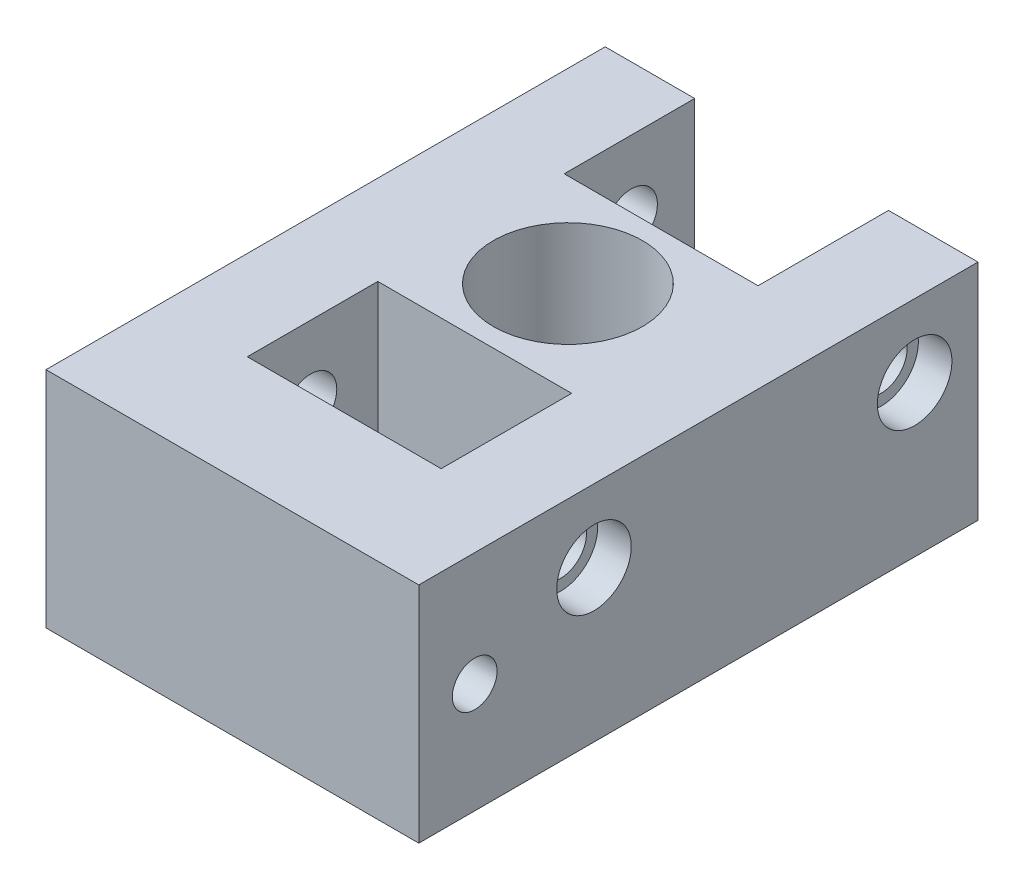
from build123d import *

# Parameters (mm, degrees)
SKETCH_1_W          = 10
SKETCH_1_H          = 12
EXTRUDE_1_DEPTH     = 6
SKETCH_2_R          = 1
CUT_EXTRUDE_1_DEPTH = 17.733200531
SKETCH_2_3_R        = 2
CUT_EXTRUDE_2_DEPTH = 4
SKETCH_3_R          = 2
CUT_EXTRUDE_3_DEPTH = 17.733200531
SKETCH_4_W          = 5.2
SKETCH_4_H          = 3.5
CUT_EXTRUDE_4_DEPTH = 4
SKETCH_6_R          = 0.7
CUT_EXTRUDE_5_DEPTH = 17.733200531
SKETCH_6_3_R        = 1
CUT_EXTRUDE_6_DEPTH = 0.9
CUT_EXTRUDE_START   = -9.1
SKETCH_6_4_R        = 1
CUT_EXTRUDE_7_DEPTH = 0.9
SKETCH_7_W          = 10
SKETCH_7_H          = 6
EXTRUDE_3_DEPTH     = 3
SKETCH_8_R          = 0.6
CUT_EXTRUDE_8_DEPTH = 20


with BuildPart() as part:
    # 草图1 → 凸台-拉伸1 (new body)
    with BuildSketch(Plane(origin=(0, 0, 0), x_dir=(1, 0, 0), z_dir=(0, 1, 0))):
        with Locations((5, -6)):
            Rectangle(SKETCH_1_W, SKETCH_1_H)
    extrude(amount=EXTRUDE_1_DEPTH)

    # 草图2 → 切除-拉伸1 (cut, through all)
    with BuildSketch(Plane(origin=(0, 6, 0), x_dir=(1, 0, 0), z_dir=(0, 1, 0))):
        with Locations(Location((5, -1.5, 0), (0, 0, 270))):
            Circle(SKETCH_2_R)
        with Locations(Location((5, -10.5, 0), (0, 0, 270))):
            Circle(SKETCH_2_R)
    extrude(amount=-CUT_EXTRUDE_1_DEPTH, mode=Mode.SUBTRACT)

    # 草图2<3> → 切除-拉伸2 (cut)
    with BuildSketch(Plane(origin=(0, 6, 0), x_dir=(1, 0, 0), z_dir=(0, 1, 0))):
        with Locations((5, -1.5)):
            Circle(SKETCH_2_3_R)
        with Locations((5, -10.5)):
            Circle(SKETCH_2_3_R)
    extrude(amount=-CUT_EXTRUDE_2_DEPTH, mode=Mode.SUBTRACT)

    # 草图3 → 切除-拉伸3 (cut, through all)
    with BuildSketch(Plane(origin=(0, 6, 0), x_dir=(1, 0, 0), z_dir=(0, 1, 0))):
        with Locations(Location((5, -6, 0), (0, 0, 270))):
            Circle(SKETCH_3_R)
    extrude(amount=-CUT_EXTRUDE_3_DEPTH, mode=Mode.SUBTRACT)

    # 草图4 → 切除-拉伸4 (cut)
    with BuildSketch(Plane(origin=(0, 6, 0), x_dir=(1, 0, 0), z_dir=(0, 1, 0))):
        with Locations((5, -1.75)):
            Rectangle(SKETCH_4_W, SKETCH_4_H)
        with Locations((5, -10.25)):
            Rectangle(SKETCH_4_W, SKETCH_4_H)
    extrude(amount=-CUT_EXTRUDE_4_DEPTH, mode=Mode.SUBTRACT)

    # 草图6 → 切除-拉伸5 (cut, through all)
    with BuildSketch(Plane.ZY):
        with Locations((1.7, 4.05)):
            Circle(SKETCH_6_R)
        with Locations((10.3, 4.05)):
            Circle(SKETCH_6_R)
    extrude(amount=-CUT_EXTRUDE_5_DEPTH, mode=Mode.SUBTRACT)

    # 草图6<3> → 切除-拉伸6 (cut)
    with BuildSketch(Plane.ZY):
        with Locations((1.7, 4.05)):
            Circle(SKETCH_6_3_R)
        with Locations((10.3, 4.05)):
            Circle(SKETCH_6_3_R)
    extrude(amount=-CUT_EXTRUDE_6_DEPTH, mode=Mode.SUBTRACT)

    # 草图6<4> → 切除-拉伸7 (cut)
    with BuildSketch(Plane.ZY.offset(CUT_EXTRUDE_START)):
        with Locations((1.7, 4.05)):
            Circle(SKETCH_6_4_R)
        with Locations((10.3, 4.05)):
            Circle(SKETCH_6_4_R)
    extrude(amount=-CUT_EXTRUDE_7_DEPTH, mode=Mode.SUBTRACT)

    # 草图7 → 凸台-拉伸3 (add)
    with BuildSketch(Plane.XY.offset(12)):
        with Locations((5, 3)):
            Rectangle(SKETCH_7_W, SKETCH_7_H)
    extrude(amount=EXTRUDE_3_DEPTH)

    # 草图8 → 切除-拉伸8 (cut, through all)
    with BuildSketch(Plane(origin=(10, 0, 0), x_dir=(0, 0, -1), z_dir=(1, 0, 0))):
        with Locations((-13.5, 2.951438323)):
            Circle(SKETCH_8_R)
    extrude(amount=-CUT_EXTRUDE_8_DEPTH, mode=Mode.SUBTRACT)


solid = part.part
